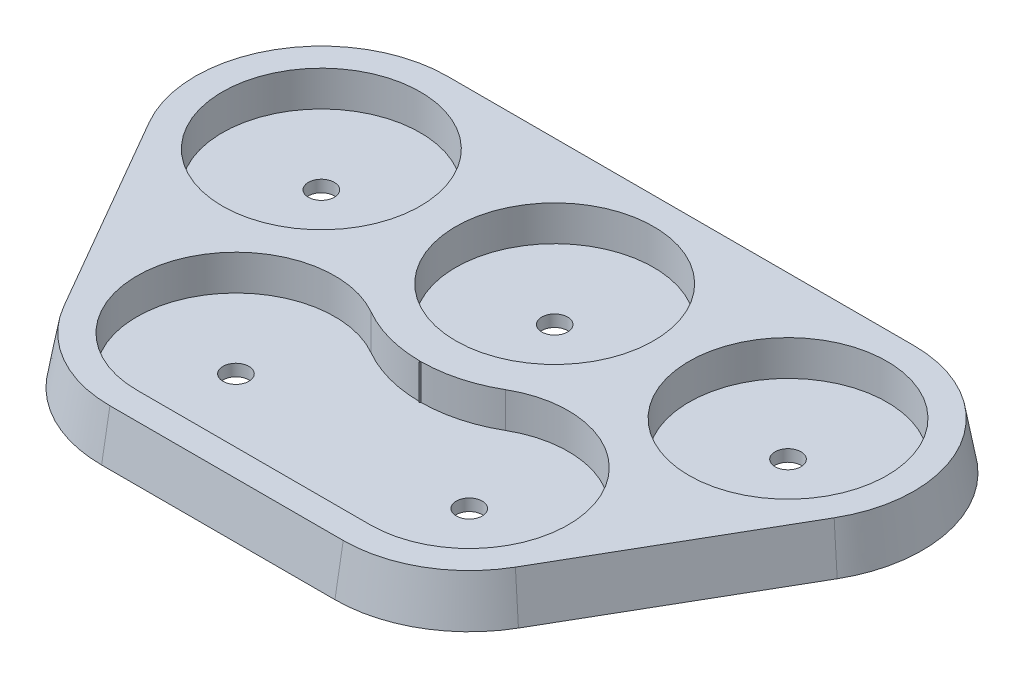
from build123d import *

# Parameters (mm, degrees)
BOSS_EXTRUDE1_DEPTH = 4
BOSS_EXTRUDE1_TAPER = 10
CUT_EXTRUDE1_START  = 4
SKETCH1_3_R         = 1.1
CUT_EXTRUDE1_DEPTH  = 4
CUT_EXTRUDE2_START  = 4
SKETCH1_4_R         = 8.4
SKETCH1_4_R_2       = 1.1
CUT_EXTRUDE2_DEPTH  = 3


with BuildPart() as part:
    # Sketch1 → Boss-Extrude1 (new body)
    with BuildSketch(Plane(origin=(0, 0, 0), x_dir=(1, 0, 0), z_dir=(0, 1, 0))):
        with BuildLine():
            Line((-49.472689603, -5.7), (-39.572689603, -22.847302995))
            ThreePointArc((-39.572689603, -22.847302995), (-35.4, -27.019992598), (-29.7, -28.547302995))
            Line((-29.7, -28.547302995), (-9.9, -28.547302995))
            ThreePointArc((-9.9, -28.547302995), (-4.2, -27.019992598), (-0.027310397, -22.847302995))
            Line((-0.027310397, -22.847302995), (9.872689603, -5.7))
            ThreePointArc((9.872689603, -5.7), (9.872689603, 5.7), (0, 11.4))
            Line((0, 11.4), (-39.6, 11.4))
            ThreePointArc((-39.6, 11.4), (-49.472689603, 5.7), (-49.472689603, -5.7))
        make_face()
    extrude(amount=BOSS_EXTRUDE1_DEPTH, taper=BOSS_EXTRUDE1_TAPER)

    # Sketch1<3> → Cut-Extrude1 (cut)
    with BuildSketch(Plane(origin=(0, 0, 0), x_dir=(1, 0, 0), z_dir=(0, 1, 0)).offset(CUT_EXTRUDE1_START)):
        with Locations(Location((-9.9, -17.147302995, 0), (0, 0, 270))):
            Circle(SKETCH1_3_R)
        with Locations(Location((-19.8, 0, 0), (0, 0, 270))):
            Circle(SKETCH1_3_R)
        with Locations(Location((0, 0, 0), (0, 0, 270))):
            Circle(SKETCH1_3_R)
        with Locations(Location((-29.7, -17.147302995, 0), (0, 0, 270))):
            Circle(SKETCH1_3_R)
        with Locations(Location((-39.6, 0, 0), (0, 0, 270))):
            Circle(SKETCH1_3_R)
    extrude(amount=-CUT_EXTRUDE1_DEPTH, mode=Mode.SUBTRACT)

    # Sketch1<4> → Cut-Extrude2 (cut)
    # profile 1 of 4: a face of its own
    with BuildSketch(Plane(origin=(0, 0, 0), x_dir=(1, 0, 0), z_dir=(0, 1, 0)).offset(CUT_EXTRUDE2_START)):
        with Locations(Location((0, 0, 0), (0, 0, 270))):
            Circle(SKETCH1_4_R)
        with Locations(Location((0, 0, 0), (0, 0, 270))):
            Circle(SKETCH1_4_R_2, mode=Mode.SUBTRACT)
    # profile 2 of 4: a face of its own
    with BuildSketch(Plane(origin=(0, 0, 0), x_dir=(1, 0, 0), z_dir=(0, 1, 0)).offset(CUT_EXTRUDE2_START)):
        with BuildLine():
            Line((-29.7, -25.547302995), (-9.9, -25.547302995))
            ThreePointArc((-9.9, -25.547302995), (-1.786223222, -14.97322241), (-14.100001087, -9.872690231))
            ThreePointArc((-14.100001087, -9.872690231), (-16.822981756, -11.004424673), (-19.745150662, -11.39986805))
            ThreePointArc((-19.745150662, -11.39986805), (-19.772689603, -11.447302995), (-19.8, -11.494869891))
            ThreePointArc((-19.8, -11.494869891), (-19.827310397, -11.447302995), (-19.854849338, -11.39986805))
            ThreePointArc((-19.854849338, -11.39986805), (-22.777018876, -11.004424502), (-25.500000049, -9.872689575))
            ThreePointArc((-25.500000049, -9.872689575), (-37.813776948, -14.973223043), (-29.7, -25.547302995))
        make_face()
        with Locations(Location((-9.9, -17.147302995, 0), (0, 0, 270))):
            Circle(SKETCH1_4_R_2, mode=Mode.SUBTRACT)
        with Locations(Location((-29.7, -17.147302995, 0), (0, 0, 270))):
            Circle(SKETCH1_4_R_2, mode=Mode.SUBTRACT)
    # profile 3 of 4: a face of its own
    with BuildSketch(Plane(origin=(0, 0, 0), x_dir=(1, 0, 0), z_dir=(0, 1, 0)).offset(CUT_EXTRUDE2_START)):
        with Locations(Location((-19.8, 0, 0), (0, 0, 270))):
            Circle(SKETCH1_4_R)
        with Locations(Location((-19.8, 0, 0), (0, 0, 270))):
            Circle(SKETCH1_4_R_2, mode=Mode.SUBTRACT)
    # profile 4 of 4: a face of its own
    with BuildSketch(Plane(origin=(0, 0, 0), x_dir=(1, 0, 0), z_dir=(0, 1, 0)).offset(CUT_EXTRUDE2_START)):
        with Locations(Location((-39.6, 0, 0), (0, 0, 270))):
            Circle(SKETCH1_4_R)
        with Locations(Location((-39.6, 0, 0), (0, 0, 270))):
            Circle(SKETCH1_4_R_2, mode=Mode.SUBTRACT)
    extrude(amount=-CUT_EXTRUDE2_DEPTH, mode=Mode.SUBTRACT)


solid = part.part
